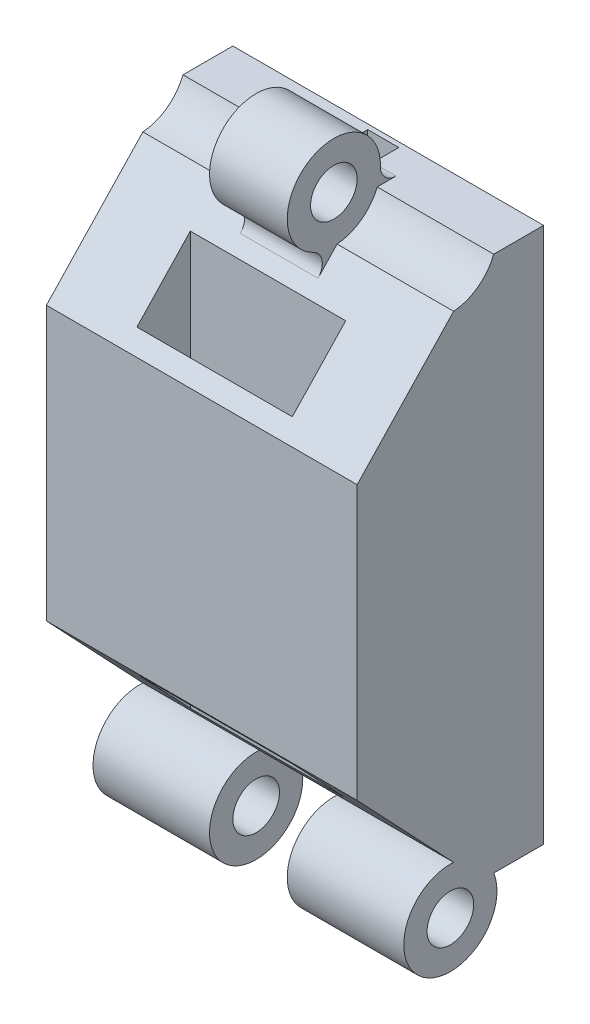
from build123d import *

# Parameters (mm, degrees)
SKETCH2_W                       = 20
SKETCH2_H                       = 34.5
BOSS_EXTRUDE1_DEPTH             = 15
CUT_EXTRUDE1_DEPTH              = 25.951202376
CUT_EXTRUDE1_DEPTH_BACK         = 25.951202376
CUT_EXTRUDE2_DEPTH              = 25.951202376
CUT_EXTRUDE2_DEPTH_BACK         = 25.951202376
CUT_EXTRUDE4_DEPTH              = 25.951202376
CUT_EXTRUDE4_DEPTH_BACK         = 25.951202376
SKETCH10_R                      = 3
SKETCH12_R                      = 3
SKETCH12_R_2                    = 1.5
BOSS_EXTRUDE4_DEPTH             = 2.5
FILLET4_R                       = 1
BOSS_EXTRUDE5_REACH             = 29.943
SKETCH13_R                      = 3
SKETCH13_R_2                    = 1.5
BOSS_EXTRUDE5_DIRECTION_2_REACH = 29.943
SKETCH14_R                      = 3
CUT_EXTRUDE6_DEPTH              = 2.5
CUT_EXTRUDE7_DEPTH              = 28.94320132
CUT_EXTRUDE7_DEPTH_BACK         = 28.94320132
CUT_EXTRUDE8_REACH              = 29.273
SKETCH17_W                      = 10
SKETCH17_H                      = 3.4375
CUT_EXTRUDE8_DIRECTION_2_REACH  = 29.273
SKETCH18_W                      = 2
SKETCH18_H                      = 38.848747282
CUT_EXTRUDE9_DEPTH              = 1


with BuildPart() as part:
    # Sketch2 → Boss-Extrude1 (new body)
    with BuildSketch(Plane.XY):
        with Locations((2, 0)):
            Rectangle(SKETCH2_W, SKETCH2_H)
    extrude(amount=BOSS_EXTRUDE1_DEPTH)

    # Sketch6 → Cut-Extrude1 (cut, two sides: drawn at the far end of the back side and taken through both)
    with BuildSketch(Plane(origin=(2, 0, 0), x_dir=(0, 0, -1), z_dir=(1, 0, 0)).offset(-CUT_EXTRUDE1_DEPTH_BACK)):
        Polygon((-4, 17.25), (-15, 5.631049961), (-15, 17.25), align=None)
    extrude(amount=CUT_EXTRUDE1_DEPTH + CUT_EXTRUDE1_DEPTH_BACK, mode=Mode.SUBTRACT)

    # Sketch8 → Cut-Extrude2 (cut, two sides: drawn at the far end of the back side and taken through both)
    with BuildSketch(Plane(origin=(2, 0, 0), x_dir=(0, 0, -1), z_dir=(1, 0, 0)).offset(-CUT_EXTRUDE2_DEPTH_BACK)):
        Polygon((-4, -17.25), (-15, -5.631049961), (-15, -17.25), align=None)
    extrude(amount=CUT_EXTRUDE2_DEPTH + CUT_EXTRUDE2_DEPTH_BACK, mode=Mode.SUBTRACT)

    # Sketch10 → Cut-Extrude4 (cut, two sides: drawn at the far end of the back side and taken through both)
    with BuildSketch(Plane(origin=(2, 0, 0), x_dir=(0, 0, -1), z_dir=(1, 0, 0)).offset(-CUT_EXTRUDE4_DEPTH_BACK)):
        with Locations((-6, 18.35)):
            Circle(SKETCH10_R)
    extrude(amount=CUT_EXTRUDE4_DEPTH + CUT_EXTRUDE4_DEPTH_BACK, mode=Mode.SUBTRACT)

    # Sketch12 → Boss-Extrude4 (add, symmetric)
    with BuildSketch(Plane(origin=(2, 0, 0), x_dir=(0, 0, -1), z_dir=(1, 0, 0))):
        with Locations((-6, 18.35)):
            Circle(SKETCH12_R)
        with Locations((-6, 18.35)):
            Circle(SKETCH12_R_2, mode=Mode.SUBTRACT)
    extrude(amount=BOSS_EXTRUDE4_DEPTH, both=True)

    # Fillet4
    fillet4_edges = [part.edges().sort_by_distance(p)[0] for p in [
        (2, 15.357223012, 5.791947362),
        (2, 17.25, 3.208942853),
    ]]
    fillet(fillet4_edges, radius=FILLET4_R)

    # Boss-Extrude5: up to this face of the body (flat: up to its plane)
    boss_extrude5_end = Plane(part.part.faces().sort_by_distance((12, -0.0739089, 6.251251182))[0])
    # Sketch13 → Boss-Extrude5 (add, up to the picked face)
    with BuildSketch(Plane(origin=(2, 0, 0), x_dir=(0, 0, -1), z_dir=(1, 0, 0)), mode=Mode.PRIVATE) as boss_extrude5_sk1:
        with Locations((-6, -18.35)):
            Circle(SKETCH13_R)
        with Locations(Location((-6, -18.35, 0), (0, 0, 180))):
            Circle(SKETCH13_R_2, mode=Mode.SUBTRACT)
    boss_extrude5_tool1 = split(extrude(boss_extrude5_sk1.sketch, amount=BOSS_EXTRUDE5_REACH, mode=Mode.PRIVATE), bisect_by=boss_extrude5_end, keep=Keep.BOTH, mode=Mode.PRIVATE)
    add(boss_extrude5_tool1.solids().sort_by(Axis((2, -18.35, 8.915147), (1, 0, 0)))[0])

    # Boss-Extrude5 direction 2: up to this face of the body (flat: up to its plane)
    boss_extrude5_direction_2_end = Plane(part.part.faces().sort_by_distance((-8, -0.0739089, 6.251251182))[0])
    # Sketch13 → Boss-Extrude5 direction 2 (add, up to the picked face)
    with BuildSketch(Plane(origin=(2, 0, 0), x_dir=(0, 0, -1), z_dir=(1, 0, 0)), mode=Mode.PRIVATE) as boss_extrude5_direction_2_sk1:
        with Locations((-6, -18.35)):
            Circle(SKETCH13_R)
        with Locations(Location((-6, -18.35, 0), (0, 0, 180))):
            Circle(SKETCH13_R_2, mode=Mode.SUBTRACT)
    boss_extrude5_direction_2_tool1 = split(extrude(boss_extrude5_direction_2_sk1.sketch, amount=-BOSS_EXTRUDE5_DIRECTION_2_REACH, mode=Mode.PRIVATE), bisect_by=boss_extrude5_direction_2_end, keep=Keep.BOTH, mode=Mode.PRIVATE)
    add(boss_extrude5_direction_2_tool1.solids().sort_by(Axis((2, -18.35, 8.915147), (-1, 0, 0)))[0])

    # Sketch14 → Cut-Extrude6 (cut, symmetric)
    with BuildSketch(Plane(origin=(2, 0, 0), x_dir=(0, 0, -1), z_dir=(1, 0, 0))):
        with Locations((-6, -18.35)):
            Circle(SKETCH14_R)
    extrude(amount=CUT_EXTRUDE6_DEPTH, both=True, mode=Mode.SUBTRACT)

    # Sketch15 → Cut-Extrude7 (cut, two sides: drawn at the far end of the back side and taken through both)
    with BuildSketch(Plane(origin=(2, 0, 0), x_dir=(0, 0, -1), z_dir=(1, 0, 0)).offset(-CUT_EXTRUDE7_DEPTH_BACK)):
        Polygon((-16.548060764, -12.233536013), (-12, -12.233536013), (-12, 0), (-12, 8.799854517), (-16.548060764, 8.799854517), (-16.548060764, -7.042323617), align=None)
    extrude(amount=CUT_EXTRUDE7_DEPTH + CUT_EXTRUDE7_DEPTH_BACK, mode=Mode.SUBTRACT)

    # Cut-Extrude8: up to this plane
    cut_extrude8_end = Plane(origin=(-8, -17.25, 4), z_dir=(0, 0.6875, -0.7261843774138907))
    # Sketch17 → Cut-Extrude8 (cut, up to the surface)
    with BuildSketch(Plane(origin=(0, 0, 0), x_dir=(1, 0, 0), z_dir=(0, 1, 0)), mode=Mode.PRIVATE) as cut_extrude8_sk1:
        with Locations((2, -9.45625)):
            Rectangle(SKETCH17_W, SKETCH17_H)
    cut_extrude8_tool1 = split(extrude(cut_extrude8_sk1.sketch, amount=-CUT_EXTRUDE8_REACH, mode=Mode.PRIVATE), bisect_by=cut_extrude8_end, keep=Keep.BOTH, mode=Mode.PRIVATE)
    add(cut_extrude8_tool1.solids().sort_by_distance((2, 0, 9.45625))[0], mode=Mode.SUBTRACT)

    # Cut-Extrude8 direction 2: up to this plane
    cut_extrude8_direction_2_end = Plane(origin=(-8, 17.25, 4), z_dir=(0, 0.6875, 0.7261843774138907))
    # Sketch17 → Cut-Extrude8 direction 2 (cut, up to the surface)
    with BuildSketch(Plane(origin=(0, 0, 0), x_dir=(1, 0, 0), z_dir=(0, 1, 0)), mode=Mode.PRIVATE) as cut_extrude8_direction_2_sk1:
        with Locations((2, -9.45625)):
            Rectangle(SKETCH17_W, SKETCH17_H)
    cut_extrude8_direction_2_tool1 = split(extrude(cut_extrude8_direction_2_sk1.sketch, amount=CUT_EXTRUDE8_DIRECTION_2_REACH, mode=Mode.PRIVATE), bisect_by=cut_extrude8_direction_2_end, keep=Keep.BOTH, mode=Mode.PRIVATE)
    add(cut_extrude8_direction_2_tool1.solids().sort_by_distance((2, 0, 9.45625))[0], mode=Mode.SUBTRACT)

    # Sketch18 → Cut-Extrude9 (cut, symmetric)
    with BuildSketch(Plane(origin=(2, 0, 0), x_dir=(0, 0, -1), z_dir=(1, 0, 0))):
        with Locations((-1.32, 2.174373641)):
            Rectangle(SKETCH18_W, SKETCH18_H)
    extrude(amount=CUT_EXTRUDE9_DEPTH, both=True, mode=Mode.SUBTRACT)


solid = part.part
